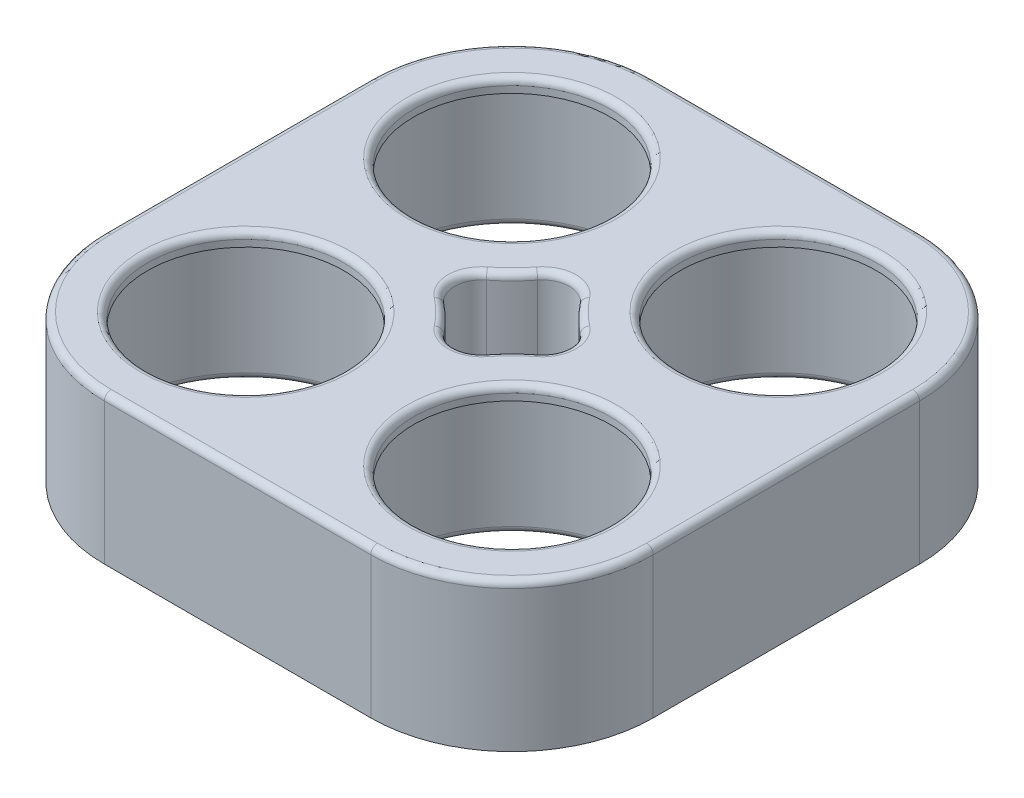
from build123d import *

# Parameters (mm, degrees)
ESQUISSE1_R             = 9.3
BOSS_EXTRU_1_DEPTH      = 10
ESQUISSE2_R             = 7.3
BOSS_EXTRU_2_DEPTH      = 1
ENL_V_MAT_EXTRU_1_DEPTH = 45.002045407
CONG_1_R                = 0.5


with BuildPart() as part:
    # Esquisse1 → Boss.-Extru.1 (new body)
    with BuildSketch(Plane(origin=(0, 0, 0), x_dir=(1, 0, 0), z_dir=(0, 1, 0))):
        with BuildLine():
            Line((-10.5, 19.8), (-10.5, 0))
            ThreePointArc((-10.5, 0), (-7.424621202, -7.424621202), (0, -10.5))
            Line((0, -10.5), (19.8, -10.5))
            ThreePointArc((19.8, -10.5), (27.224621202, -7.424621202), (30.3, 0))
            Line((30.3, 0), (30.3, 19.8))
            ThreePointArc((30.3, 19.8), (27.224621202, 27.224621202), (19.8, 30.3))
            Line((19.8, 30.3), (0, 30.3))
            ThreePointArc((0, 30.3), (-7.424621202, 27.224621202), (-10.5, 19.8))
        make_face()
        with Locations(Location((0, 0, 0), (0, 0, 270))):
            Circle(ESQUISSE1_R, mode=Mode.SUBTRACT)
        with Locations(Location((0, 19.8, 0), (0, 0, 270))):
            Circle(ESQUISSE1_R, mode=Mode.SUBTRACT)
        with Locations(Location((19.8, 0, 0), (0, 0, 270))):
            Circle(ESQUISSE1_R, mode=Mode.SUBTRACT)
        with Locations(Location((19.8, 19.8, 0), (0, 0, 270))):
            Circle(ESQUISSE1_R, mode=Mode.SUBTRACT)
        with BuildLine():
            ThreePointArc((6.410471434, 11.484), (7.424621202, 12.375378798), (8.316, 13.389528566))
            ThreePointArc((8.316, 13.389528566), (9.9, 14.168486389), (11.484, 13.389528566))
            ThreePointArc((11.484, 13.389528566), (12.375378798, 12.375378798), (13.389528566, 11.484))
            ThreePointArc((13.389528566, 11.484), (14.168486389, 9.9), (13.389528566, 8.316))
            ThreePointArc((13.389528566, 8.316), (12.375378798, 7.424621202), (11.484, 6.410471434))
            ThreePointArc((11.484, 6.410471434), (9.9, 5.631513611), (8.316, 6.410471434))
            ThreePointArc((8.316, 6.410471434), (7.424621202, 7.424621202), (6.410471434, 8.316))
            ThreePointArc((6.410471434, 8.316), (5.631513611, 9.9), (6.410471434, 11.484))
        make_face(mode=Mode.SUBTRACT)
    extrude(amount=BOSS_EXTRU_1_DEPTH)

    # Esquisse2 → Boss.-Extru.2 (add)
    with BuildSketch(Plane(origin=(0, 10, 0), x_dir=(1, 0, 0), z_dir=(0, 1, 0))):
        with BuildLine():
            Line((-10.5, 19.8), (-10.5, 0))
            ThreePointArc((-10.5, 0), (-7.424621202, -7.424621202), (0, -10.5))
            Line((0, -10.5), (19.8, -10.5))
            ThreePointArc((19.8, -10.5), (27.224621202, -7.424621202), (30.3, 0))
            Line((30.3, 0), (30.3, 19.8))
            ThreePointArc((30.3, 19.8), (27.224621202, 27.224621202), (19.8, 30.3))
            Line((19.8, 30.3), (0, 30.3))
            ThreePointArc((0, 30.3), (-7.424621202, 27.224621202), (-10.5, 19.8))
        make_face()
        with Locations(Location((0, 19.8, 0), (0, 0, 270))):
            Circle(ESQUISSE2_R, mode=Mode.SUBTRACT)
        with Locations(Location((19.8, 19.8, 0), (0, 0, 270))):
            Circle(ESQUISSE2_R, mode=Mode.SUBTRACT)
        with Locations(Location((19.8, 0, 0), (0, 0, 270))):
            Circle(ESQUISSE2_R, mode=Mode.SUBTRACT)
        with Locations(Location((0, 0, 0), (0, 0, 270))):
            Circle(ESQUISSE2_R, mode=Mode.SUBTRACT)
    extrude(amount=BOSS_EXTRU_2_DEPTH)

    # Esquisse3 → Enlèv. mat.-Extru.1 (cut, through all)
    with BuildSketch(Plane.XZ.offset(-10)):
        with BuildLine():
            ThreePointArc((6.410471434, -8.316), (7.424621202, -7.424621202), (8.316, -6.410471434))
            ThreePointArc((8.316, -6.410471434), (9.9, -5.631513611), (11.484, -6.410471434))
            ThreePointArc((11.484, -6.410471434), (12.375378798, -7.424621202), (13.389528566, -8.316))
            ThreePointArc((13.389528566, -8.316), (14.168486389, -9.9), (13.389528566, -11.484))
            ThreePointArc((13.389528566, -11.484), (12.375378798, -12.375378798), (11.484, -13.389528566))
            ThreePointArc((11.484, -13.389528566), (9.9, -14.168486389), (8.316, -13.389528566))
            ThreePointArc((8.316, -13.389528566), (7.424621202, -12.375378798), (6.410471434, -11.484))
            ThreePointArc((6.410471434, -11.484), (5.631513611, -9.9), (6.410471434, -8.316))
        make_face()
    extrude(amount=-ENL_V_MAT_EXTRU_1_DEPTH, mode=Mode.SUBTRACT)

    # Congé1
    cong_1_edges = [part.edges().sort_by_distance(p)[0] for p in [
        (5.631513611, 11, -9.9),
        (7.424621202, 11, -7.424621202),
        (9.9, 11, -5.631513611),
        (12.375378798, 11, -7.424621202),
        (14.168486389, 11, -9.9),
        (12.375378798, 11, -12.375378798),
        (9.9, 11, -14.168486389),
        (7.424621202, 11, -12.375378798),
        (0, 0, -9.3),
        (0, 0, -29.1),
        (5.631513611, 0, -9.9),
        (7.424621202, 0, -7.424621202),
        (9.9, 0, -5.631513611),
        (12.375378798, 0, -7.424621202),
        (14.168486389, 0, -9.9),
        (12.375378798, 0, -12.375378798),
        (9.9, 0, -14.168486389),
        (7.424621202, 0, -12.375378798),
        (19.8, 0, -9.3),
        (19.8, 0, -29.1),
        (-7.424621202, 11, -27.224621202),
        (-10.5, 11, -9.9),
        (-7.424621202, 11, 7.424621202),
        (9.9, 11, 10.5),
        (27.224621202, 11, 7.424621202),
        (30.3, 11, -9.9),
        (27.224621202, 11, -27.224621202),
        (9.9, 11, -30.3),
        (0, 11, -27.1),
        (19.8, 11, -27.1),
        (19.8, 11, -7.3),
        (0, 11, -7.3),
    ]]
    fillet(cong_1_edges, radius=CONG_1_R)


solid = part.part
